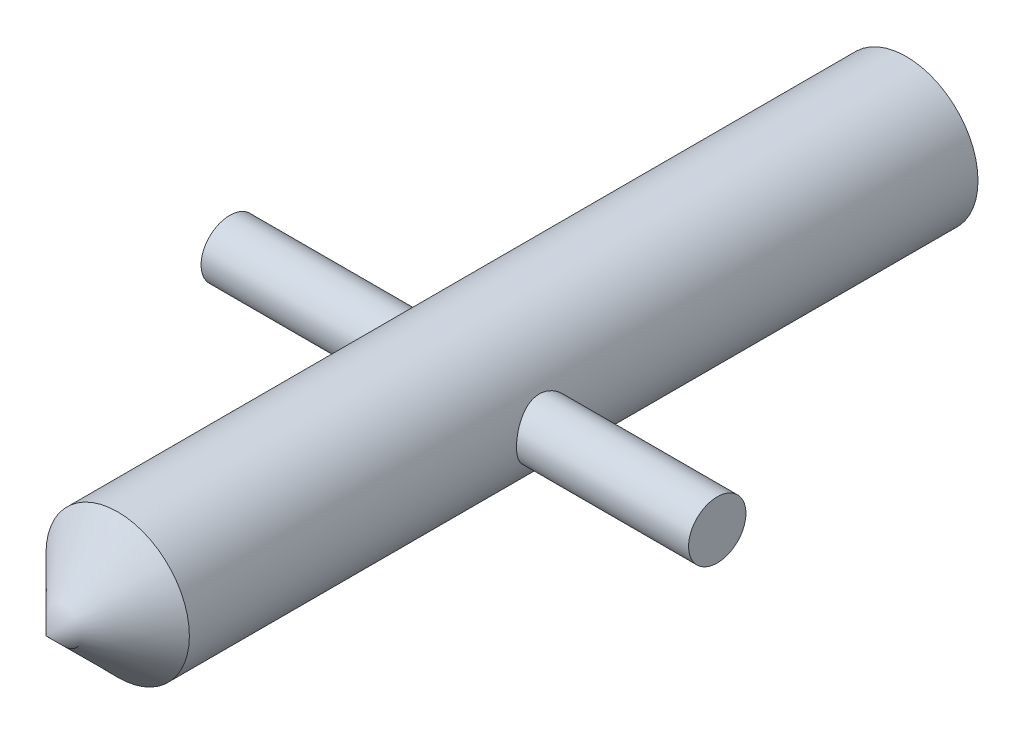
from build123d import *

# Parameters (mm, degrees)
SKETCH_27_R      = 5
EXTRUDE_14_DEPTH = 60
CHAMFER_2_SIZE   = 5
SKETCH_29_R      = 2
EXTRUDE_15_DEPTH = 17


with BuildPart() as part:
    # 草图27 → 凸台-拉伸14 (new body)
    with BuildSketch(Plane.XY):
        Circle(SKETCH_27_R)
    extrude(amount=EXTRUDE_14_DEPTH)

    # 倒角2
    chamfer_2_edges = [part.edges().sort_by_distance(p)[0] for p in [
        (-5, 0, 60),
    ]]
    chamfer(chamfer_2_edges, length=CHAMFER_2_SIZE)

    # 草图29 → 凸台-拉伸15 (add, symmetric)
    with BuildSketch(Plane(origin=(0, 0, 0), x_dir=(0, 0, -1), z_dir=(1, 0, 0))):
        with Locations((-30.18471694, 0)):
            Circle(SKETCH_29_R)
    extrude(amount=EXTRUDE_15_DEPTH, both=True)


solid = part.part
